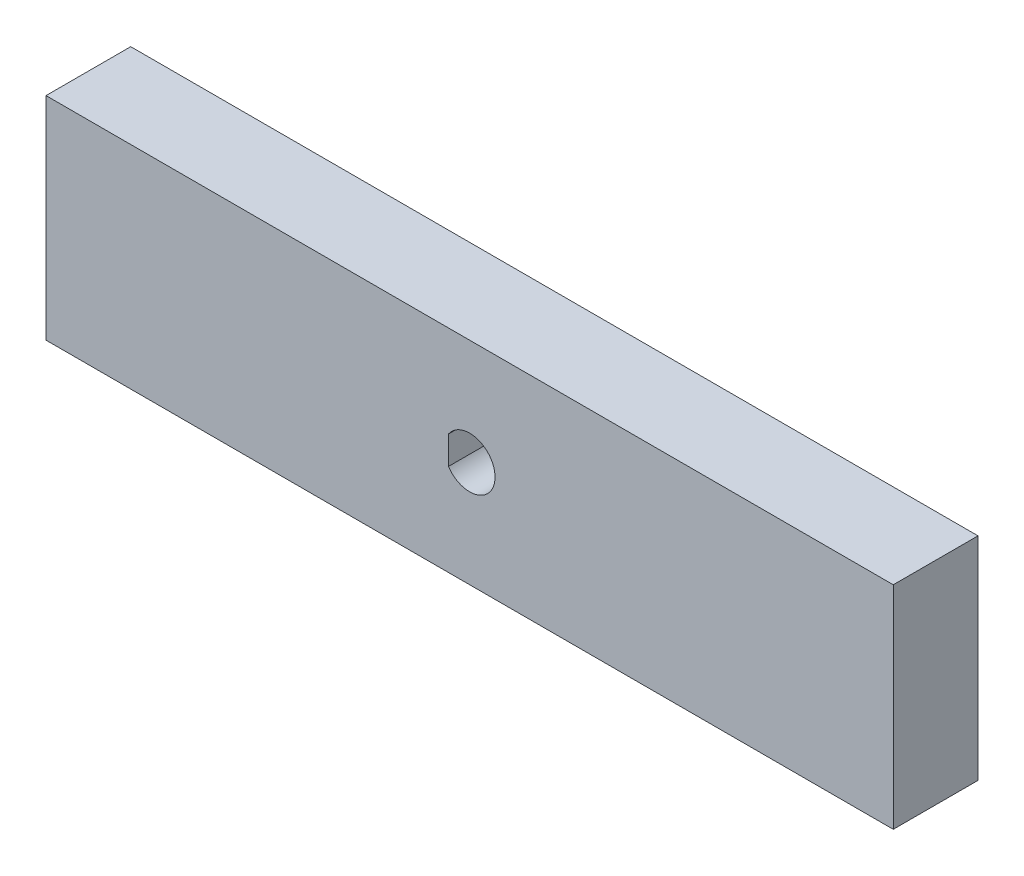
from build123d import *

# Parameters (mm, degrees)
SKETCH1_W           = 100
SKETCH1_H           = 25
BOSS_EXTRUDE1_DEPTH = 10
CUT_EXTRUDE1_DEPTH  = 10


with BuildPart() as part:
    # Sketch1 → Boss-Extrude1 (new body)
    with BuildSketch(Plane.XY):
        Rectangle(SKETCH1_W, SKETCH1_H)
    extrude(amount=BOSS_EXTRUDE1_DEPTH)

    # Sketch2 → Cut-Extrude1 (cut)
    with BuildSketch(Plane.XY.offset(10)):
        with BuildLine():
            Line((-2.5, 1.658312395), (-2.5, -1.658312395))
            ThreePointArc((-2.5, -1.658312395), (3, 0), (-2.5, 1.658312395))
        make_face()
    extrude(amount=-CUT_EXTRUDE1_DEPTH, mode=Mode.SUBTRACT)


solid = part.part
